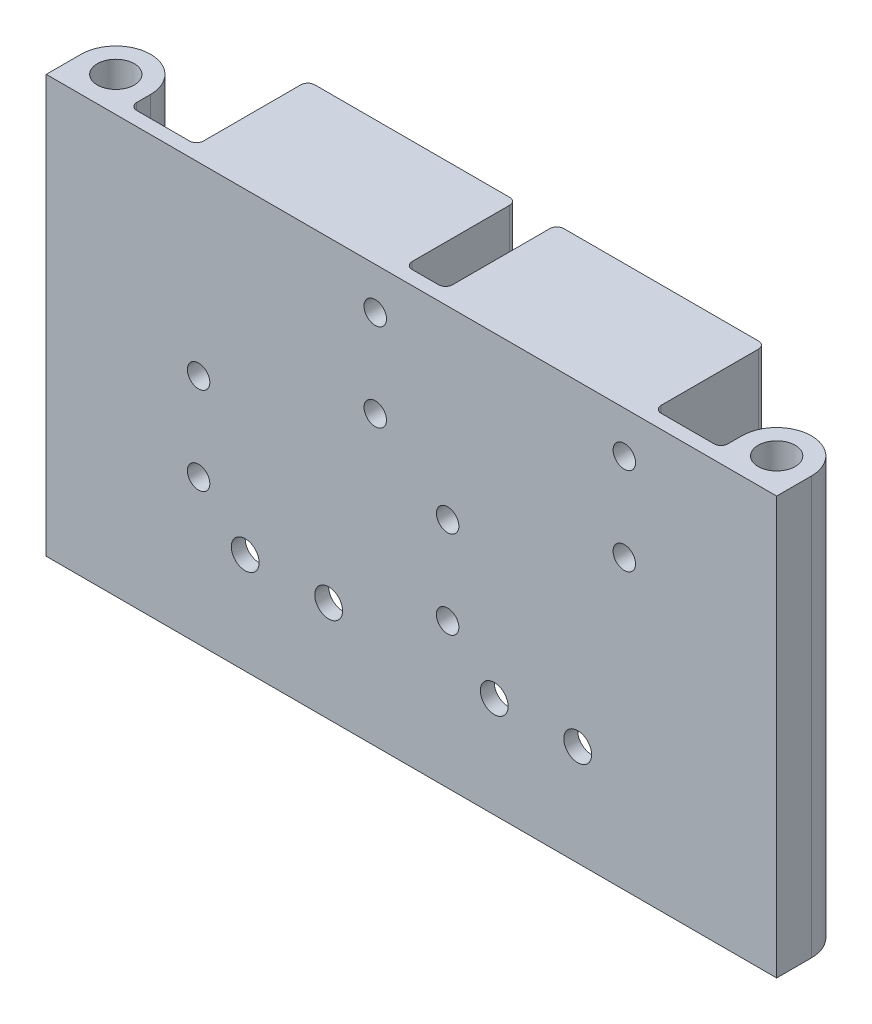
from build123d import *

# Parameters (mm, degrees)
BOSS_EXTRUDE1_DEPTH     = 38.1
F_1_4_CLEARANCE_HOLE1_D = 6.7564
FILLET1_R               = 1.27
SKETCH23_W              = 38.1
SKETCH23_H              = 20.32
BOSS_EXTRUDE2_DEPTH     = 3.175
BOSS_EXTRUDE3_DEPTH     = 50.8
LPATTERN1_COUNT         = 2
LPATTERN1_PITCH         = 45.466
LPATTERN1_COUNT_DIR2    = 2
LPATTERN1_PITCH_DIR2    = 16.002
LPATTERN2_COUNT         = 2
LPATTERN2_PITCH         = 45.466
LPATTERN2_COUNT_DIR2    = 2
LPATTERN2_PITCH_DIR2    = 16.002
SKETCH33_R              = 2.54
CUT_EXTRUDE1_DEPTH      = 80.435936609
MIRROR7_COPY_1_SKETCH_R = 2.54
MIRROR7_COPY_1_DEPTH    = 80.435936609
SKETCH37_W              = 5.842
SKETCH37_H              = 17.272
CUT_EXTRUDE4_DEPTH      = 7.62
FILLET2_R               = 1.27


with BuildPart() as part:
    # Sketch1 → Boss-Extrude1 (new, symmetric)
    with BuildSketch(Plane(origin=(0, 0, 0), x_dir=(1, 0, 0), z_dir=(0, 1, 0))):
        with BuildLine():
            Line((0, -6.35), (66.675, -6.35))
            Line((66.675, -6.35), (66.675, 0))
            ThreePointArc((66.675, 0), (60.324997065, 6.349997065), (53.975, -5.869e-06))
            Line((53.975, -5.869e-06), (53.975, -3.81))
            Line((53.975, -3.81), (-53.975, -3.81))
            Line((-53.975, -3.81), (-53.975, 0))
            ThreePointArc((-53.975, 0), (-60.325, 6.35), (-66.675, 0))
            Line((-66.675, 0), (-66.675, -6.35))
            Line((-66.675, -6.35), (0, -6.35))
        make_face()
    extrude(amount=BOSS_EXTRUDE1_DEPTH, both=True)

    # 1/4 Clearance Hole1 (through all)
    with Locations(Plane(origin=(0, 38.1, 0), x_dir=(1, 0, 0), z_dir=(0, 1, 0))):
        with Locations((-60.325, 0)):
            f_1_4_clearance_hole1 = Hole(F_1_4_CLEARANCE_HOLE1_D / 2)

    # Mirror4: 1/4 Clearance Hole1 across plane
    add(f_1_4_clearance_hole1.mirror(Plane(origin=(0, 0, 0), x_dir=(0, 0, 1), z_dir=(1, 0, 0))), mode=Mode.SUBTRACT)

    # Fillet1
    fillet1_edges = [part.edges().sort_by_distance(p)[0] for p in [
        (-53.975, 0, 3.81),
        (53.975, 0, 3.81),
    ]]
    fillet(fillet1_edges, radius=FILLET1_R)

    # Sketch23 → Boss-Extrude2 (add)
    with BuildSketch(Plane(origin=(0, 38.1, 0), x_dir=(1, 0, 0), z_dir=(0, 1, 0))):
        with Locations((-22.733, 6.35)):
            Rectangle(SKETCH23_W, SKETCH23_H)
    boss_extrude2 = extrude(amount=-BOSS_EXTRUDE2_DEPTH)

    # Sketch24 → Boss-Extrude3 (add)
    with BuildSketch(Plane.XZ.offset(-34.925)):
        Polygon((-35.941, 3.81), (-41.783, 3.81), (-41.783, -16.51), (-22.733, -16.51), (-22.733, -13.462), (-35.941, -13.462), align=None)
        Polygon((-22.733, -13.462), (-22.733, -16.51), (-3.683, -16.51), (-3.683, 3.81), (-9.525, 3.81), (-9.525, -13.462), align=None)
    boss_extrude3 = extrude(amount=BOSS_EXTRUDE3_DEPTH)

    # Mirror5: Boss-Extrude2, Boss-Extrude3 across plane
    add(boss_extrude2.mirror(Plane(origin=(0, 0, 0), x_dir=(0, 0, 1), z_dir=(1, 0, 0))))
    add(boss_extrude3.mirror(Plane(origin=(0, 0, 0), x_dir=(0, 0, 1), z_dir=(1, 0, 0))))

    # Sketch30 → Ø1.0 mm Dowel Holes1 (revolve, cut)
    with BuildSketch(Plane(origin=(-6.604, 30.48, 6.35), x_dir=(0, -1, 0), z_dir=(1, 0, 0))):
        Polygon((0, 0), (0, 6.831753069), (2.05, 5.5999888), (2.05, 0), align=None)
    f_1_0_mm_dowel_holes1 = revolve(axis=Axis((-6.604, 30.48, 12.7), (0, 0, -1)), mode=Mode.SUBTRACT)

    # LPattern1: 1.0 mm Dowel Holes1 2 × 2
    with Locations(*[(i * LPATTERN1_PITCH, -j * LPATTERN1_PITCH_DIR2, 0) for i in range(LPATTERN1_COUNT) for j in range(LPATTERN1_COUNT_DIR2) if (i, j) != (0, 0)]):
        add(f_1_0_mm_dowel_holes1, mode=Mode.SUBTRACT)

    # Sketch32 → Ø1.0 mm Dowel Holes2 (revolve, cut)
    with BuildSketch(Plane(origin=(6.604, 4.318, 6.35), x_dir=(0, -1, 0), z_dir=(1, 0, 0))):
        Polygon((0, 0), (0, 6.831753069), (2.05, 5.5999888), (2.05, 0), align=None)
    f_1_0_mm_dowel_holes2 = revolve(axis=Axis((6.604, 4.318, 12.7), (0, 0, -1)), mode=Mode.SUBTRACT)

    # LPattern2: 1.0 mm Dowel Holes2 2 × 2
    with Locations(*[(-i * LPATTERN2_PITCH, -j * LPATTERN2_PITCH_DIR2, 0) for i in range(LPATTERN2_COUNT) for j in range(LPATTERN2_COUNT_DIR2) if (i, j) != (0, 0)]):
        add(f_1_0_mm_dowel_holes2, mode=Mode.SUBTRACT)

    # Sketch33 → Cut-Extrude1 (cut, through all)
    with BuildSketch(Plane(origin=(0, 0, 3.81), x_dir=(-1, 0, 0), z_dir=(0, 0, -1))):
        with Locations((-30.353, -19.685)):
            Circle(SKETCH33_R)
    cut_extrude1 = extrude(amount=-CUT_EXTRUDE1_DEPTH, mode=Mode.SUBTRACT)

    # Mirror6: Cut-Extrude1 across plane
    add(cut_extrude1.mirror(Plane.ZY.offset(-22.733)), mode=Mode.SUBTRACT)

    # Mirror7: Cut-Extrude1 across plane
    add(cut_extrude1.mirror(Plane(origin=(0, 0, 0), x_dir=(0, 0, 1), z_dir=(1, 0, 0))), mode=Mode.SUBTRACT)

    # Mirror7 copy 1 sketch → Mirror7 copy 1 (cut, through all)
    with BuildSketch(Plane(origin=(-45.466, 0, 3.81), x_dir=(-1, 0, 0), z_dir=(0, 0, -1))):
        with Locations((-30.353, -19.685)):
            Circle(MIRROR7_COPY_1_SKETCH_R)
    extrude(amount=-MIRROR7_COPY_1_DEPTH, mode=Mode.SUBTRACT)

    # Sketch37 → Cut-Extrude4 (cut)
    with BuildSketch(Plane.XZ.offset(15.875)):
        with Locations((38.862, -4.826)):
            Rectangle(SKETCH37_W, SKETCH37_H)
    cut_extrude4 = extrude(amount=-CUT_EXTRUDE4_DEPTH, mode=Mode.SUBTRACT)

    # Mirror11: Cut-Extrude4 across plane
    add(cut_extrude4.mirror(Plane.ZY.offset(-16.129)), mode=Mode.SUBTRACT)

    # Fillet2
    fillet2_edges = [part.edges().sort_by_distance(p)[0] for p in [
        (9.525, -15.875, -4.826),
        (41.783, 14.9225, 3.81),
        (35.941, -8.255, -4.826),
        (-3.683, 14.9225, 3.81),
        (-9.525, -8.255, -4.826),
        (-41.783, 11.1125, 3.81),
        (-41.783, 11.1125, -16.51),
        (-3.683, 11.1125, -16.51),
        (-35.941, -15.875, -4.826),
        (41.783, 11.1125, -16.51),
        (3.683, 11.1125, 3.81),
        (3.683, 11.1125, -16.51),
    ]]
    fillet(fillet2_edges, radius=FILLET2_R)


solid = part.part
